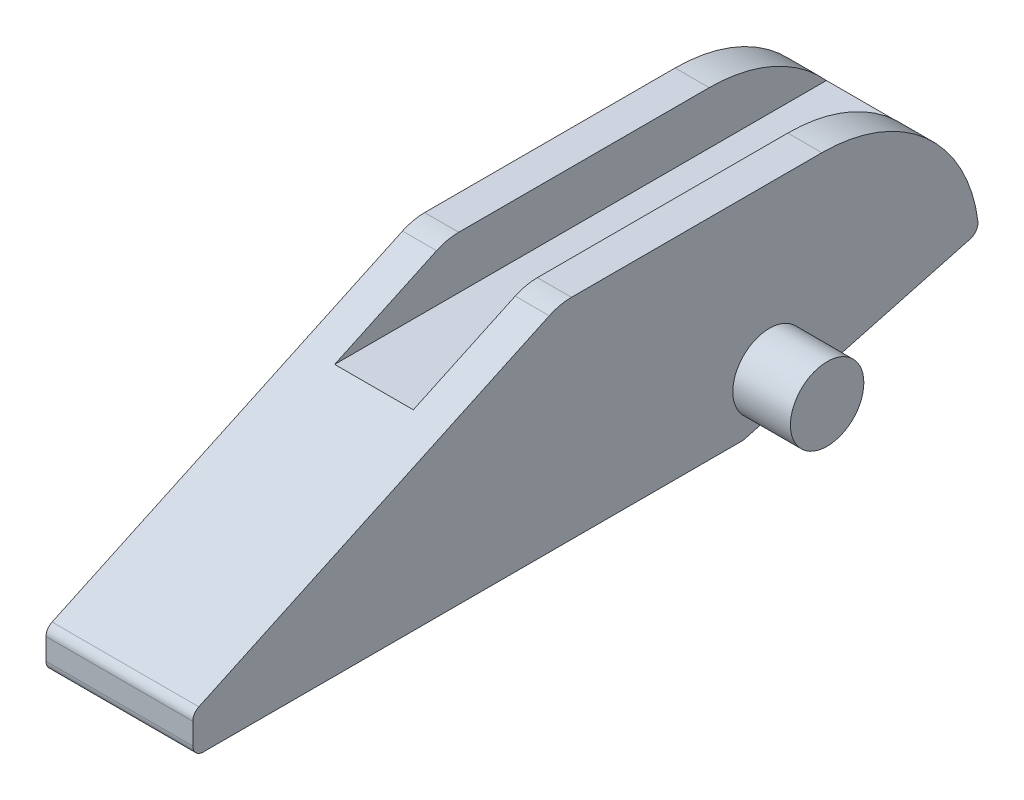
from build123d import *

# Parameters (mm, degrees)
PROFILE_DEPTH         = 1.4
PIVOTTABS_R           = 0.7
PIVOTTAB_DEPTH        = 2.5
TOPCUTS_W             = 1.5
TOPCUTS_H             = 15
TOPCUT_DEPTH          = 1
PIVOTSLANT_DEPTH      = 16.724185194
PIVOTSLANT_DEPTH_BACK = 16.724185194
PIVOTSLANTF_R         = 0.2
BOTTOMCAVITYS_W       = 1.6
BOTTOMCAVITYS_H       = 8.2736695
BOTTOMCAVITY_DEPTH    = 1
BOTTOMCAVITYF_R       = 0.2


with BuildPart() as part:
    # ProfileS → Profile (new, symmetric)
    with BuildSketch(Plane(origin=(0, 0, 0), x_dir=(0, 0, -1), z_dir=(1, 0, 0))):
        with BuildLine():
            Line((0, 0), (-15, 0))
            Line((-15, 0), (-15, 0.608001659))
            ThreePointArc((-15, 0.608001659), (-14.968678289, 0.715461581), (-14.884523652, 0.789263217))
            Line((-14.884523652, 0.789263217), (-8.2, 3.906307787))
            ThreePointArc((-8.2, 3.906307787), (-7.993821352, 3.976296007), (-7.777381738, 4))
            Line((-7.777381738, 4), (-3, 4))
            ThreePointArc((-3, 4), (-0.878679656, 3.121320344), (0, 1))
            Line((0, 1), (0, 0))
        make_face()
    extrude(amount=PROFILE_DEPTH, both=True)

    # PivotTabS → PivotTab (add, symmetric)
    with BuildSketch(Plane(origin=(0, 0, 0), x_dir=(0, 0, -1), z_dir=(1, 0, 0))):
        with Locations(Location((-4, 0.9, 0), (0, 0, 180))):
            Circle(PIVOTTABS_R)
    extrude(amount=PIVOTTAB_DEPTH, both=True)

    # TopCutS → TopCut (cut)
    with BuildSketch(Plane(origin=(0, 4, 18.512140764), x_dir=(1, 0, 0), z_dir=(0, -1, 0))):
        with Locations((0, -11.012140764)):
            Rectangle(TOPCUTS_W, TOPCUTS_H)
    extrude(amount=TOPCUT_DEPTH, mode=Mode.SUBTRACT)

    # PivotSlantS → PivotSlant (cut, two sides: drawn at the far end of the back side and taken through both)
    with BuildSketch(Plane(origin=(0, 0, 0), x_dir=(0, 0, -1), z_dir=(1, 0, 0)).offset(-PIVOTSLANT_DEPTH_BACK)):
        Polygon((-4.5, 0), (0, 1.205771366), (0, 0), align=None)
    extrude(amount=PIVOTSLANT_DEPTH + PIVOTSLANT_DEPTH_BACK, mode=Mode.SUBTRACT)

    # PivotSlantF
    pivotslantf_edges = [part.edges().sort_by_distance(p)[0] for p in [
        (0, 0, 15),
        (0, 0, 4.5),
        (0, 1.203912318, 0.006938062),
    ]]
    fillet(pivotslantf_edges, radius=PIVOTSLANTF_R)

    # BottomCavityS → BottomCavity (cut)
    with BuildSketch(Plane(origin=(0, 0, 0), x_dir=(-1, 0, 0), z_dir=(0, -1, 0))):
        with Locations((0, -9.66316525)):
            Rectangle(BOTTOMCAVITYS_W, BOTTOMCAVITYS_H)
    extrude(amount=-BOTTOMCAVITY_DEPTH, mode=Mode.SUBTRACT)

    # BottomCavityF
    bottomcavityf_edges = [part.edges().sort_by_distance(p)[0] for p in [
        (-0.8, 1, 9.66316525),
        (-0.8, 0.5, 5.5263305),
        (0, 1, 13.8),
        (-0.8, 0.5, 13.8),
        (0.8, 1, 9.66316525),
        (0.8, 0.5, 13.8),
        (0, 1, 5.5263305),
        (0.8, 0.5, 5.5263305),
    ]]
    fillet(bottomcavityf_edges, radius=BOTTOMCAVITYF_R)


solid = part.part
